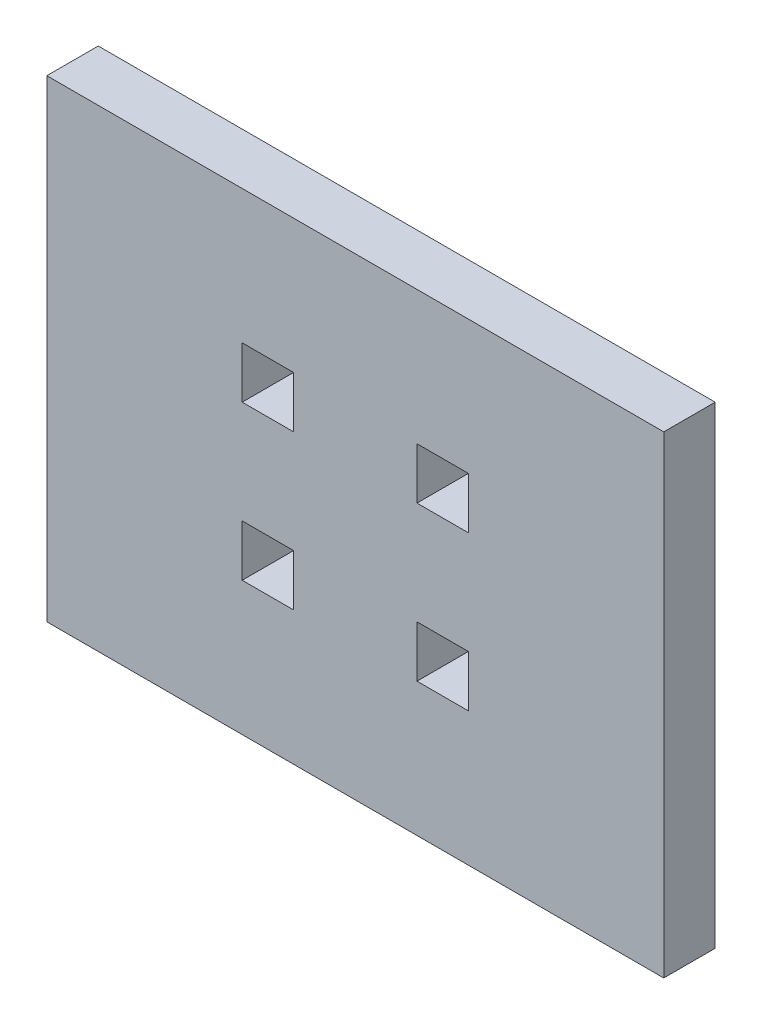
from build123d import *

# Parameters (mm, degrees)
ESQUISSE1_W        = 60
ESQUISSE1_H        = 46
ESQUISSE1_W_2      = 12
ESQUISSE1_H_2      = 30
BOSS_EXTRU_1_DEPTH = 5


with BuildPart() as part:
    # Esquisse1 → Boss.-Extru.1 (new body)
    # profile 1 of 2: a face of its own
    with BuildSketch(Plane.XY):
        with Locations((-3.893592945, 15.1875)):
            Rectangle(ESQUISSE1_W, ESQUISSE1_H)
        Polygon((-14.893592945, 25.1875), (-9.893592945, 25.1875), (-9.893592945, 30.1875), (2.106407055, 30.1875), (2.106407055, 25.1875), (7.106407055, 25.1875), (7.106407055, 20.1875), (2.106407055, 20.1875), (2.106407055, 10.1875), (7.106407055, 10.1875), (7.106407055, 5.1875), (2.106407055, 5.1875), (2.106407055, 0.1875), (-9.893592945, 0.1875), (-9.893592945, 5.1875), (-14.893592945, 5.1875), (-14.893592945, 10.1875), (-9.893592945, 10.1875), (-9.893592945, 20.1875), (-14.893592945, 20.1875), align=None, mode=Mode.SUBTRACT)
    # profile 2 of 2: a face of its own
    with BuildSketch(Plane.XY):
        with Locations((-3.893592945, 15.1875)):
            Rectangle(ESQUISSE1_W_2, ESQUISSE1_H_2)
    extrude(amount=BOSS_EXTRU_1_DEPTH)


solid = part.part
